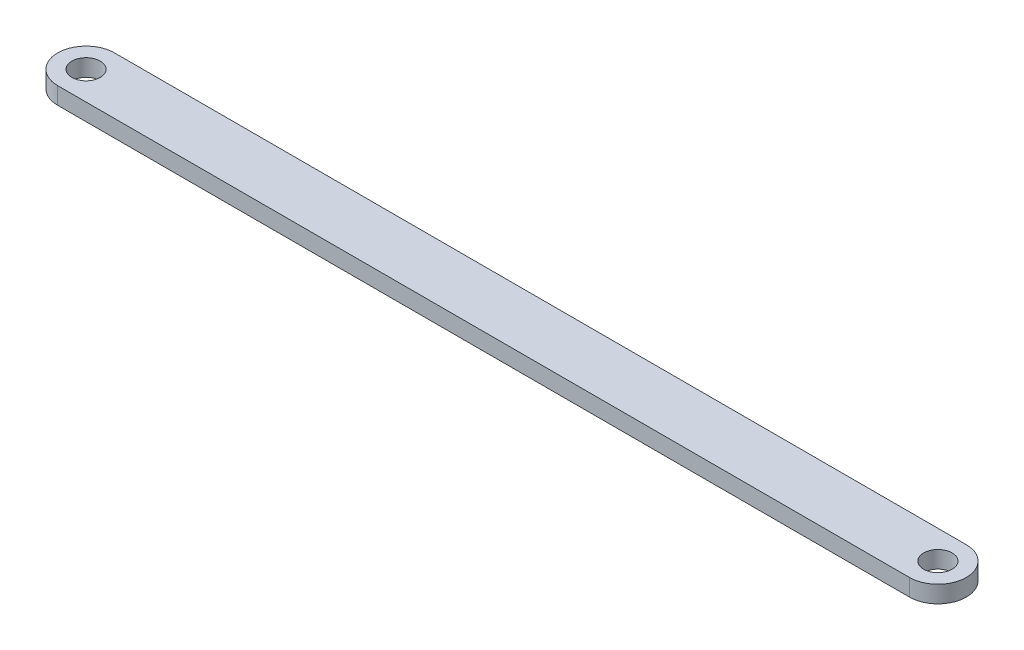
from build123d import *

# Parameters (mm, degrees)
SKETCH1_R           = 2.5
BOSS_EXTRUDE1_DEPTH = 3


with BuildPart() as part:
    # Sketch1 → Boss-Extrude1 (new body)
    with BuildSketch(Plane(origin=(0, 0, 0), x_dir=(1, 0, 0), z_dir=(0, 1, 0))):
        with BuildLine():
            Line((0, 5), (150, 5))
            ThreePointArc((150, 5), (155, 0), (150, -5))
            Line((150, -5), (0, -5))
            ThreePointArc((0, -5), (-5, 0), (0, 5))
        make_face()
        with Locations(Location((0, 0, 0), (0, 0, 270))):
            Circle(SKETCH1_R, mode=Mode.SUBTRACT)
        with Locations(Location((150, 0, 0), (0, 0, 270))):
            Circle(SKETCH1_R, mode=Mode.SUBTRACT)
    extrude(amount=BOSS_EXTRUDE1_DEPTH)


solid = part.part
